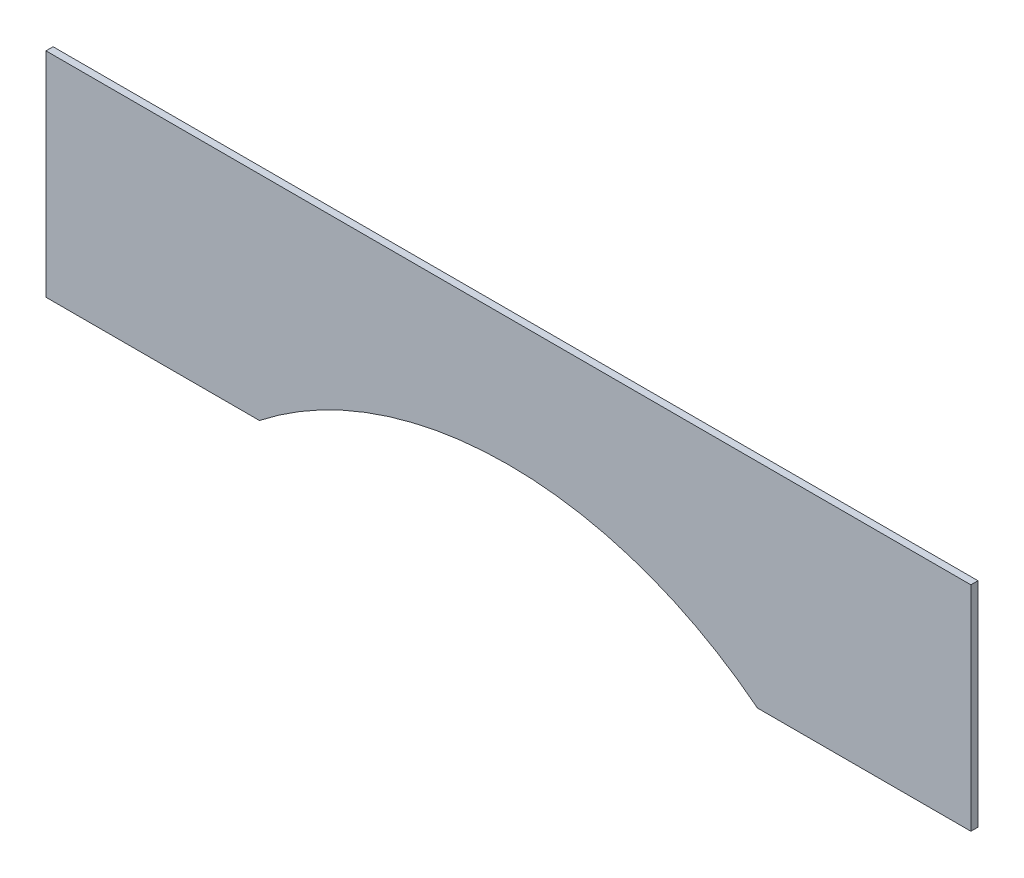
from build123d import *

# Parameters (mm, degrees)
BOSS_EXTRUDE1_DEPTH = 2.54


with BuildPart() as part:
    # Sketch1 → Boss-Extrude1 (new body)
    with BuildSketch(Plane.XY):
        with BuildLine():
            Line((0, 0), (76.2, 0))
            ThreePointArc((76.2, 0), (165.1, 30.804028837), (254, 0))
            Line((254, 0), (330.2, 0))
            Line((330.2, 0), (330.2, 76.2))
            Line((330.2, 76.2), (0, 76.2))
            Line((0, 76.2), (0, 0))
        make_face()
    extrude(amount=BOSS_EXTRUDE1_DEPTH)


solid = part.part
